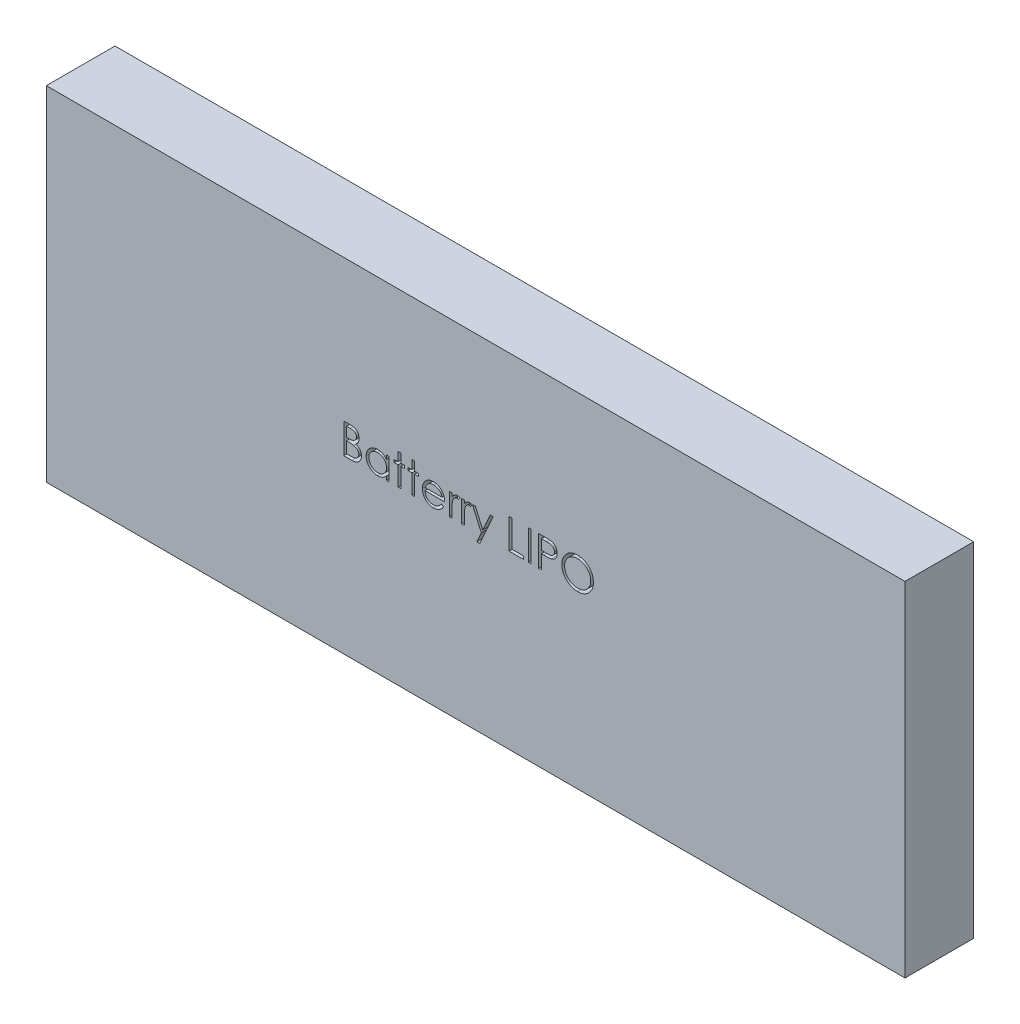
from build123d import *

# Parameters (mm, degrees)
CROQUIS1_W              = 100
CROQUIS1_H              = 40
SALIENTE_EXTRUIR1_DEPTH = 4
CROQUIS2_W              = 0.314102564
CROQUIS2_H              = 3.5
CORTAR_EXTRUIR1_DEPTH   = 25


with BuildPart() as part:
    # Croquis1 → Saliente-Extruir1 (new, symmetric)
    with BuildSketch(Plane.XY):
        Rectangle(CROQUIS1_W, CROQUIS1_H)
    extrude(amount=SALIENTE_EXTRUIR1_DEPTH, both=True)

    # Croquis2 → Cortar-Extruir1 (cut)
    # profile 1 of 12: a face of its own
    with BuildSketch(Plane.XY.offset(4)):
        with BuildLine():
            add(Edge.make_bspline(
                [(11.85499255, 3.58974359), (11.919800656, 3.58810211), (12.047089123, 3.584878109), (12.23416402, 3.560199006), (12.412759116, 3.517503616), (12.584329255, 3.460640633), (12.746822231, 3.384786248), (12.901461124, 3.2931011), (13.047877997, 3.184624641), (13.184099379, 3.060195414), (13.308756329, 2.92481196), (13.418582215, 2.78033405), (13.510624509, 2.627635248), (13.586210296, 2.467174417), (13.645508906, 2.299314449), (13.68642795, 2.123160446), (13.7125661, 1.939853756), (13.715621877, 1.814826892), (13.717172037, 1.751402244)],
                knots=[0, 0, 0, 0, 1.065120563, 2.091984664, 3.0946048, 4.079830382, 5.057816894, 6.036188127, 7.030412546, 8.04752943, 9.064399622, 10.05169764, 11.02544977, 11.989514704, 12.962713494, 13.945757189, 14.957906945, 16, 16, 16, 16], degree=3))
            add(Edge.make_bspline(
                [(13.717172037, 1.751402244), (13.715622104, 1.688444797), (13.712567008, 1.564348377), (13.68639823, 1.382204933), (13.64535723, 1.207114236), (13.586760964, 1.039368583), (13.511535486, 0.87879102), (13.418880315, 0.725804066), (13.309739104, 0.580357567), (13.185532253, 0.444044902), (13.050131211, 0.319047431), (12.904900944, 0.210128556), (12.753107624, 0.116404431), (12.592797916, 0.041620757), (12.426097879, -0.018151163), (12.251515556, -0.058903793), (12.069869002, -0.085190837), (11.945997998, -0.088209353), (11.883037422, -0.08974359)],
                knots=[0, 0, 0, 0, 1.043624062, 2.057103931, 3.04512605, 4.022047818, 4.998200453, 5.980619268, 6.982898556, 8.009068085, 9.034988726, 10.034168286, 11.015286542, 11.987931943, 12.962482838, 13.94673481, 14.956375938, 16, 16, 16, 16], degree=3))
            add(Edge.make_bspline(
                [(11.883037422, -0.08974359), (11.819613103, -0.088194203), (11.694586887, -0.085139949), (11.511049851, -0.058958544), (11.334772107, -0.01801724), (11.166257756, 0.040492196), (11.005412827, 0.116109427), (10.851922744, 0.208313806), (10.706403597, 0.317720947), (10.57006185, 0.441887521), (10.445312652, 0.577059073), (10.336553276, 0.721893329), (10.244328163, 0.873548785), (10.168964831, 1.032446309), (10.109300371, 1.197817752), (10.068595553, 1.370766229), (10.042259601, 1.550305735), (10.039224755, 1.672548634), (10.037684858, 1.734575321)],
                knots=[0, 0, 0, 0, 1.053102029, 2.075944431, 3.073151272, 4.055350789, 5.033113405, 6.020478099, 7.024410459, 8.052272461, 9.079885166, 10.07527673, 11.055994387, 12.023226415, 12.992069828, 13.970394897, 14.97016774, 16, 16, 16, 16], degree=3))
            add(Edge.make_bspline(
                [(10.037684858, 1.734575321), (10.038219493, 1.77620799), (10.039282019, 1.858948113), (10.052073712, 1.981814713), (10.070635413, 2.102705371), (10.097237326, 2.221276319), (10.132028993, 2.337237304), (10.17308102, 2.451388067), (10.223220865, 2.56257179), (10.279901513, 2.671315182), (10.343163321, 2.775923088), (10.413039071, 2.874802671), (10.487074439, 2.968783668), (10.568237833, 3.055430672), (10.653854278, 3.137264328), (10.745312656, 3.213027045), (10.842054901, 3.283401996), (10.94449728, 3.346822337), (11.050115555, 3.404181472), (11.158992333, 3.453403323), (11.269648905, 3.495649384), (11.382603552, 3.529890209), (11.497556325, 3.556922245), (11.614758109, 3.575329599), (11.734115535, 3.588153917), (11.814526854, 3.589211419), (11.85499255, 3.58974359)],
                knots=[0, 0, 0, 0, 1.037015668, 2.060948919, 3.074880161, 4.083647147, 5.086022904, 6.090072063, 7.104153813, 8.122640571, 9.144368836, 10.147691507, 11.138137339, 12.123020368, 13.103399296, 14.087645067, 15.080126199, 16.082011238, 17.087798457, 18.072939717, 19.057185487, 20.037253025, 21.01195951, 21.997135196, 22.992090687, 24, 24, 24, 24], degree=3))
        make_face()
        with BuildLine():
            add(Edge.make_bspline(
                [(11.870417229, 3.230769231), (11.837202596, 3.230364341), (11.771090863, 3.229558431), (11.672806327, 3.218942715), (11.575814393, 3.203812826), (11.480095031, 3.182231305), (11.386048741, 3.152827253), (11.2927989, 3.118986345), (11.201195846, 3.077765254), (11.111541988, 3.03119255), (11.024626913, 2.979643629), (10.942614212, 2.922671862), (10.865291568, 2.861613307), (10.792848301, 2.79632547), (10.725497129, 2.726475868), (10.661912427, 2.653123432), (10.604642846, 2.574171541), (10.552157269, 2.491761134), (10.505189429, 2.405999553), (10.463424074, 2.317789691), (10.429260065, 2.226412004), (10.401397689, 2.132857846), (10.378297878, 2.037275387), (10.363663954, 1.938939538), (10.352931595, 1.838344426), (10.352171749, 1.770362572), (10.351787422, 1.735977564)],
                knots=[0, 0, 0, 0, 1.008559885, 2.007477868, 2.99961109, 3.989939068, 4.984837346, 5.991145699, 7.001802488, 8.033829008, 9.059044045, 10.069351652, 11.065060232, 12.050310815, 13.029377138, 14.011219647, 14.996725999, 15.989392538, 16.977580475, 17.965360261, 18.951710183, 19.937753436, 20.929683414, 21.935841486, 22.955955122, 24, 24, 24, 24], degree=3))
            add(Edge.make_bspline(
                [(10.351787422, 1.735977564), (10.353062284, 1.685415343), (10.355570331, 1.585943813), (10.377527902, 1.440175669), (10.411349876, 1.300087383), (10.461207242, 1.166445474), (10.523557857, 1.038101191), (10.600584747, 0.916193086), (10.691843833, 0.800688212), (10.79550736, 0.692392943), (10.908830066, 0.593547138), (11.029162796, 0.50678373), (11.155216404, 0.43337348), (11.287319606, 0.373568408), (11.424767145, 0.32617867), (11.568444696, 0.293700039), (11.717395156, 0.272324583), (11.818925811, 0.270271827), (11.870417229, 0.269230769)],
                knots=[0, 0, 0, 0, 1.032063989, 2.030389145, 3.003944642, 3.970395727, 4.937377036, 5.913328081, 6.909231446, 7.93887556, 8.970685674, 9.976071282, 10.964166581, 11.944589148, 12.933237628, 13.927779006, 14.949070134, 16, 16, 16, 16], degree=3))
            add(Edge.make_bspline(
                [(11.870417229, 0.269230769), (11.905026731, 0.269706274), (11.973667767, 0.270649342), (12.07576329, 0.280148018), (12.176019501, 0.295379888), (12.274295781, 0.317310543), (12.370480593, 0.34475775), (12.464975396, 0.377365478), (12.556773686, 0.418046682), (12.647033524, 0.462994633), (12.733429766, 0.514234791), (12.815905298, 0.56927294), (12.892381278, 0.630241561), (12.964770349, 0.694559374), (13.032398038, 0.763523221), (13.094807022, 0.837043443), (13.151787155, 0.9155841), (13.204252801, 0.997869506), (13.251056064, 1.083865759), (13.291835163, 1.172395437), (13.326431279, 1.263240546), (13.354359784, 1.356532118), (13.376245245, 1.452092966), (13.391325165, 1.550051045), (13.401873604, 1.650210387), (13.402668681, 1.717954243), (13.403069473, 1.752103365)],
                knots=[0, 0, 0, 0, 1.047197238, 2.076906641, 3.100256066, 4.114471768, 5.12198147, 6.126382909, 7.136867548, 8.15857795, 9.17633901, 10.174870724, 11.156907918, 12.133735059, 13.104061851, 14.077631395, 15.04955518, 16.038496417, 17.029181396, 18.010275684, 18.986308667, 19.968651475, 20.955262928, 21.950658345, 22.966943676, 24, 24, 24, 24], degree=3))
            add(Edge.make_bspline(
                [(13.403069473, 1.752103365), (13.40266836, 1.78601887), (13.401872678, 1.85329652), (13.391330204, 1.952757338), (13.376229313, 2.05001055), (13.354466605, 2.144674353), (13.326416452, 2.236772878), (13.291829121, 2.326219625), (13.251043822, 2.413347821), (13.204235597, 2.497942118), (13.151619774, 2.579116855), (13.094125531, 2.656719268), (13.030760183, 2.729292009), (12.963334158, 2.798626703), (12.890163272, 2.863244593), (12.811578978, 2.923167114), (12.7285353, 2.979840388), (12.640608065, 3.03096595), (12.549864111, 3.078180182), (12.456750153, 3.118631186), (12.362321054, 3.153003305), (12.266816941, 3.18232027), (12.169433963, 3.2037283), (12.070830134, 3.21895635), (11.971141876, 3.229554736), (11.904098656, 3.230363114), (11.870417229, 3.230769231)],
                knots=[0, 0, 0, 0, 1.02996197, 2.043119294, 3.035359645, 4.018872909, 4.991431989, 5.957985074, 6.929999688, 7.912076566, 8.892894881, 9.867085534, 10.843653904, 11.817741046, 12.803660682, 13.806313499, 14.818574707, 15.856120519, 16.894564902, 17.924820532, 18.937903209, 19.946497019, 20.957711757, 21.963978472, 22.977135795, 24, 24, 24, 24], degree=3))
        make_face(mode=Mode.SUBTRACT)
    # profile 2 of 12: a face of its own
    with BuildSketch(Plane.XY.offset(4)):
        with BuildLine():
            Line((7.345377165, 3.5), (8.031775402, 3.5))
            add(Edge.make_bspline(
                [(8.031775402, 3.5), (8.078986309, 3.499948104), (8.169444501, 3.499848668), (8.299159557, 3.496833922), (8.416969289, 3.49280723), (8.52261967, 3.487225337), (8.616435768, 3.480628747), (8.697993067, 3.471376708), (8.767932624, 3.461716412), (8.809839073, 3.451895005), (8.828950883, 3.447415865)],
                knots=[0, 0, 0, 0, 1.415646017, 2.712440637, 3.8905458, 4.950247383, 5.884950622, 6.709939814, 7.411656543, 8, 8, 8, 8], degree=3))
            add(Edge.make_bspline(
                [(8.828950883, 3.447415865), (8.853144417, 3.440793916), (8.900961394, 3.427706054), (8.969862437, 3.40149233), (9.035416283, 3.370410165), (9.097847841, 3.334986225), (9.156389924, 3.293700661), (9.211915965, 3.248227043), (9.263935946, 3.197515475), (9.312157337, 3.142134735), (9.356442135, 3.083014525), (9.394571818, 3.019272295), (9.426499045, 2.951980992), (9.453882316, 2.881187421), (9.473590771, 2.806297097), (9.48843767, 2.727830385), (9.497861298, 2.645795695), (9.49876386, 2.589735827), (9.499223319, 2.561197917)],
                knots=[0, 0, 0, 0, 0.999701418, 1.975846123, 2.934577507, 3.890451536, 4.834027766, 5.787354733, 6.749476667, 7.726910423, 8.712836071, 9.690891519, 10.682875813, 11.679750201, 12.712814741, 13.765529915, 14.8625177, 16, 16, 16, 16], degree=3))
            add(Edge.make_bspline(
                [(9.499223319, 2.561197917), (9.498801894, 2.53242014), (9.497977348, 2.476114476), (9.488081063, 2.393741688), (9.474750871, 2.315023298), (9.454253819, 2.240133847), (9.427408146, 2.169518077), (9.395916093, 2.102096845), (9.357932563, 2.039017173), (9.314287733, 1.980050055), (9.265736139, 1.925140143), (9.212483201, 1.874685348), (9.154743908, 1.82898101), (9.09270176, 1.787924666), (9.025751911, 1.752468387), (8.954909758, 1.720711082), (8.879559541, 1.694040021), (8.827417027, 1.68000996), (8.800906011, 1.672876603)],
                knots=[0, 0, 0, 0, 1.121902311, 2.195077645, 3.232258892, 4.234102512, 5.217864754, 6.176164875, 7.132989551, 8.084763148, 9.034132444, 9.988522005, 10.94243251, 11.903244335, 12.886203696, 13.894208494, 14.929344452, 16, 16, 16, 16], degree=3))
            add(Edge.make_bspline(
                [(8.800906011, 1.672876603), (8.778978677, 1.668213621), (8.73092365, 1.657994427), (8.651780928, 1.64658597), (8.559635542, 1.63684837), (8.454613262, 1.629547232), (8.336808357, 1.623296864), (8.2061571, 1.61832877), (8.062403023, 1.615598916), (7.962131778, 1.615458123), (7.90978021, 1.615384615)],
                knots=[0, 0, 0, 0, 0.601384939, 1.31797006, 2.144135048, 3.087295005, 4.142315834, 5.309527816, 6.595305764, 8, 8, 8, 8], degree=3))
            Line((7.90978021, 1.615384615), (7.659479729, 1.615384615))
            Line((7.659479729, 1.615384615), (7.659479729, 0))
            Line((7.659479729, 0), (7.345377165, 0))
            Line((7.345377165, 0), (7.345377165, 3.5))
        make_face()
        with BuildLine():
            Line((7.659479729, 3.141025641), (7.659479729, 1.974358974))
            Line((7.659479729, 1.974358974), (8.272260178, 1.966646635))
            add(Edge.make_bspline(
                [(8.272260178, 1.966646635), (8.302180104, 1.966631171), (8.359939904, 1.966601319), (8.443376127, 1.970586542), (8.520785414, 1.975187075), (8.59192999, 1.981922998), (8.656841924, 1.991444256), (8.715629453, 2.001055994), (8.767836736, 2.014961356), (8.828935938, 2.033684426), (8.897019285, 2.065617041), (8.971086834, 2.111966931), (9.03385742, 2.17104764), (9.088175717, 2.237475471), (9.131281595, 2.3113746), (9.162837587, 2.390443537), (9.181378744, 2.473871387), (9.183864938, 2.530959525), (9.185120755, 2.559795673)],
                knots=[0, 0, 0, 0, 1.160613943, 2.240541288, 3.23993089, 4.169200891, 5.011653406, 5.7853311, 6.478053781, 7.106038997, 8.262395093, 9.384106736, 10.481365981, 11.59014053, 12.70357646, 13.786202915, 14.881775077, 16, 16, 16, 16], degree=3))
            add(Edge.make_bspline(
                [(9.185120755, 2.559795673), (9.183858108, 2.587934187), (9.181348123, 2.643870069), (9.16269226, 2.725848829), (9.131342946, 2.804084534), (9.087886352, 2.877057619), (9.035145222, 2.943246423), (8.973845879, 3.00074355), (8.904132618, 3.046965253), (8.839284387, 3.076798534), (8.7816832, 3.09501381), (8.731651241, 3.10775865), (8.675160566, 3.117934257), (8.612192787, 3.126173759), (8.543235953, 3.133227221), (8.467697638, 3.138013198), (8.385863995, 3.140814654), (8.329053424, 3.140953609), (8.299603928, 3.141025641)],
                knots=[0, 0, 0, 0, 1.120700087, 2.227813068, 3.331159281, 4.466773991, 5.599788987, 6.693661531, 7.80175334, 8.91857717, 9.525282508, 10.207424825, 10.974604443, 11.810962634, 12.737642355, 13.736264703, 14.826523623, 16, 16, 16, 16], degree=3))
            Line((8.299603928, 3.141025641), (7.659479729, 3.141025641))
        make_face(mode=Mode.SUBTRACT)
    # profile 3 of 12: a face of its own
    with BuildSketch(Plane.XY.offset(4)):
        with Locations((6.290889986, 1.75)):
            Rectangle(CROQUIS2_W, CROQUIS2_H)
    # profile 4 of 12: a face of its own
    with BuildSketch(Plane.XY.offset(4)):
        Polygon((3.89024896, 3.5), (4.204351524, 3.5), (4.204351524, 0.358974359), (5.55050537, 0.358974359), (5.55050537, 0), (3.89024896, 0), align=None)
    # profile 5 of 12: a face of its own
    with BuildSketch(Plane.XY.offset(4)):
        Polygon((-0.372571553, 2.557692308), (-0.033929726, 2.557692308), (0.831955691, 0.598758013), (1.711162422, 2.557692308), (2.05050537, 2.557692308), (0.47999255, -0.942307692), (0.140649601, -0.942307692), (0.661583095, 0.218048878), align=None)
    # profile 6 of 12: a face of its own
    with BuildSketch(Plane.XY.offset(4)):
        with BuildLine():
            Line((-1.628981809, 2.557692308), (-1.314879245, 2.557692308))
            Line((-1.314879245, 2.557692308), (-1.314879245, 2.181189904))
            add(Edge.make_bspline(
                [(-1.314879245, 2.181189904), (-1.291690486, 2.216245732), (-1.247342165, 2.283289731), (-1.173629236, 2.371959032), (-1.098125905, 2.445374079), (-1.020470717, 2.503877598), (-0.940092618, 2.547690717), (-0.858755666, 2.579783752), (-0.775180196, 2.598761067), (-0.719018272, 2.601294726), (-0.690880848, 2.602564103)],
                knots=[0, 0, 0, 0, 1.2804753, 2.448899062, 3.506932113, 4.484331642, 5.4025378, 6.288909075, 7.142734305, 8, 8, 8, 8], degree=3))
            add(Edge.make_bspline(
                [(-0.690880848, 2.602564103), (-0.669054521, 2.601373576), (-0.624145436, 2.59892399), (-0.556162846, 2.581713165), (-0.486119394, 2.554235143), (-0.440977007, 2.52839492), (-0.417443348, 2.514923878)],
                knots=[0, 0, 0, 0, 0.901110191, 1.854092781, 2.881294221, 4, 4, 4, 4], degree=3))
            Line((-0.417443348, 2.514923878), (-0.589919309, 2.242888622))
            add(Edge.make_bspline(
                [(-0.589919309, 2.242888622), (-0.60502833, 2.249628888), (-0.633708145, 2.262423203), (-0.675662711, 2.277565213), (-0.714344048, 2.286481129), (-0.738987606, 2.287831847), (-0.7504762, 2.288461538)],
                knots=[0, 0, 0, 0, 1.180555205, 2.24091978, 3.179933427, 4, 4, 4, 4], degree=3))
            add(Edge.make_bspline(
                [(-0.7504762, 2.288461538), (-0.775681934, 2.286781501), (-0.827094324, 2.283354712), (-0.902578823, 2.256415904), (-0.975826029, 2.212890664), (-1.033997691, 2.164619552), (-1.079039944, 2.118071755), (-1.111180169, 2.077423352), (-1.140662916, 2.031844721), (-1.168833137, 1.982115037), (-1.194499431, 1.927385191), (-1.2184541, 1.868201977), (-1.240112963, 1.804496849), (-1.252463207, 1.760114328), (-1.258789501, 1.737379808)],
                knots=[0, 0, 0, 0, 1.125678352, 2.296057538, 3.5422874, 4.923748041, 5.663163013, 6.437101912, 7.23742474, 8.08941207, 8.991984279, 9.93940061, 10.944477711, 12, 12, 12, 12], degree=3))
            add(Edge.make_bspline(
                [(-1.258789501, 1.737379808), (-1.263521895, 1.717102634), (-1.274003787, 1.672190235), (-1.284195324, 1.596841711), (-1.294264842, 1.507818052), (-1.301361461, 1.404871459), (-1.307939503, 1.288259015), (-1.311649585, 1.15780307), (-1.314752726, 1.013369718), (-1.314835792, 0.912395365), (-1.314879245, 0.859575321)],
                knots=[0, 0, 0, 0, 0.566838948, 1.255505196, 2.06880316, 3.007127437, 4.065329342, 5.249902469, 6.561414163, 8, 8, 8, 8], degree=3))
            Line((-1.314879245, 0.859575321), (-1.314879245, 0))
            Line((-1.314879245, 0), (-1.628981809, 0))
            Line((-1.628981809, 0), (-1.628981809, 2.557692308))
        make_face()
    # profile 7 of 12: a face of its own
    with BuildSketch(Plane.XY.offset(4)):
        with BuildLine():
            Line((-3.064879245, 2.557692308), (-2.750776681, 2.557692308))
            Line((-2.750776681, 2.557692308), (-2.750776681, 2.181189904))
            add(Edge.make_bspline(
                [(-2.750776681, 2.181189904), (-2.727587922, 2.216245732), (-2.683239601, 2.283289731), (-2.609526672, 2.371959032), (-2.534023341, 2.445374079), (-2.456368153, 2.503877598), (-2.375990053, 2.547690717), (-2.294653102, 2.579783752), (-2.211077632, 2.598761067), (-2.154915708, 2.601294726), (-2.126778284, 2.602564103)],
                knots=[0, 0, 0, 0, 1.2804753, 2.448899062, 3.506932113, 4.484331642, 5.4025378, 6.288909075, 7.142734305, 8, 8, 8, 8], degree=3))
            add(Edge.make_bspline(
                [(-2.126778284, 2.602564103), (-2.104951957, 2.601373576), (-2.060042872, 2.59892399), (-1.992060282, 2.581713165), (-1.92201683, 2.554235143), (-1.876874443, 2.52839492), (-1.853340784, 2.514923878)],
                knots=[0, 0, 0, 0, 0.901110191, 1.854092781, 2.881294221, 4, 4, 4, 4], degree=3))
            Line((-1.853340784, 2.514923878), (-2.025816745, 2.242888622))
            add(Edge.make_bspline(
                [(-2.025816745, 2.242888622), (-2.040925766, 2.249628888), (-2.069605581, 2.262423203), (-2.111560147, 2.277565213), (-2.150241484, 2.286481129), (-2.174885042, 2.287831847), (-2.186373636, 2.288461538)],
                knots=[0, 0, 0, 0, 1.180555205, 2.24091978, 3.179933427, 4, 4, 4, 4], degree=3))
            add(Edge.make_bspline(
                [(-2.186373636, 2.288461538), (-2.21157937, 2.286781501), (-2.26299176, 2.283354712), (-2.338476259, 2.256415904), (-2.411723464, 2.212890664), (-2.469895127, 2.164619552), (-2.51493738, 2.118071755), (-2.547077605, 2.077423352), (-2.576560352, 2.031844721), (-2.604730573, 1.982115037), (-2.630396867, 1.927385191), (-2.654351536, 1.868201977), (-2.676010399, 1.804496849), (-2.688360643, 1.760114328), (-2.694686937, 1.737379808)],
                knots=[0, 0, 0, 0, 1.125678352, 2.296057538, 3.5422874, 4.923748041, 5.663163013, 6.437101912, 7.23742474, 8.08941207, 8.991984279, 9.93940061, 10.944477711, 12, 12, 12, 12], degree=3))
            add(Edge.make_bspline(
                [(-2.694686937, 1.737379808), (-2.699419331, 1.717102634), (-2.709901222, 1.672190235), (-2.72009276, 1.596841711), (-2.730162278, 1.507818052), (-2.737258897, 1.404871459), (-2.743836939, 1.288259015), (-2.747547021, 1.15780307), (-2.750650161, 1.013369718), (-2.750733228, 0.912395365), (-2.750776681, 0.859575321)],
                knots=[0, 0, 0, 0, 0.566838948, 1.255505196, 2.06880316, 3.007127437, 4.065329342, 5.249902469, 6.561414163, 8, 8, 8, 8], degree=3))
            Line((-2.750776681, 0.859575321), (-2.750776681, 0))
            Line((-2.750776681, 0), (-3.064879245, 0))
            Line((-3.064879245, 0), (-3.064879245, 2.557692308))
        make_face()
    # profile 8 of 12: a face of its own
    with BuildSketch(Plane.XY.offset(4)):
        with BuildLine():
            Line((-4.017002642, 0.807692308), (-3.737956168, 0.661157853))
            add(Edge.make_bspline(
                [(-3.737956168, 0.661157853), (-3.760192763, 0.621714521), (-3.803456372, 0.544973418), (-3.87785712, 0.439541558), (-3.955849192, 0.344693842), (-4.04095316, 0.262964188), (-4.130622839, 0.191712803), (-4.225355494, 0.129374978), (-4.325644312, 0.076256458), (-4.431494037, 0.03150393), (-4.543793588, -0.002905564), (-4.662815104, -0.027209785), (-4.7887866, -0.042233054), (-4.875132779, -0.043978194), (-4.919346392, -0.044871795)],
                knots=[0, 0, 0, 0, 1.120438281, 2.179929193, 3.190490725, 4.156257408, 5.095198341, 6.022838206, 6.959905092, 7.901321166, 8.864066838, 9.862729781, 10.905609505, 12, 12, 12, 12], degree=3))
            add(Edge.make_bspline(
                [(-4.919346392, -0.044871795), (-4.96848837, -0.04372462), (-5.064350132, -0.041486813), (-5.203889879, -0.022194348), (-5.335269297, 0.00927801), (-5.458481001, 0.053243552), (-5.573223253, 0.110670876), (-5.679724108, 0.180630358), (-5.778543634, 0.262762612), (-5.866567843, 0.357779056), (-5.945811726, 0.459461013), (-6.015737546, 0.565416898), (-6.074194977, 0.675380122), (-6.121747587, 0.788650646), (-6.160152452, 0.90451454), (-6.186919156, 1.024026007), (-6.202348904, 1.146861592), (-6.204713349, 1.229958927), (-6.205904886, 1.271834936)],
                knots=[0, 0, 0, 0, 1.145258523, 2.234067595, 3.276747158, 4.290159414, 5.277019952, 6.260822364, 7.254936242, 8.264827045, 9.274100331, 10.257902744, 11.220704747, 12.172965371, 13.118907548, 14.062713208, 15.023725156, 16, 16, 16, 16], degree=3))
            add(Edge.make_bspline(
                [(-6.205904886, 1.271834936), (-6.204845745, 1.311129766), (-6.202746666, 1.389006931), (-6.189515879, 1.504272476), (-6.166067586, 1.616300928), (-6.133891262, 1.725185376), (-6.092340016, 1.83074351), (-6.041507797, 1.933039574), (-5.981315419, 2.031964713), (-5.934842745, 2.094367847), (-5.911433732, 2.125801282)],
                knots=[0, 0, 0, 0, 1.024358464, 2.0301432, 3.019427413, 4.004406732, 4.986367066, 5.972626655, 6.978780325, 8, 8, 8, 8], degree=3))
            add(Edge.make_bspline(
                [(-5.911433732, 2.125801282), (-5.879726049, 2.163670152), (-5.817315103, 2.238208303), (-5.711758747, 2.336146628), (-5.597458551, 2.418190404), (-5.475846925, 2.48619754), (-5.345510451, 2.537871187), (-5.20820116, 2.576378769), (-5.062355574, 2.59795678), (-4.962650353, 2.601004614), (-4.911634053, 2.602564103)],
                knots=[0, 0, 0, 0, 1.030682036, 2.02871468, 2.997146059, 3.962720338, 4.930598197, 5.918074684, 6.934738563, 8, 8, 8, 8], degree=3))
            add(Edge.make_bspline(
                [(-4.911634053, 2.602564103), (-4.859186447, 2.601210054), (-4.756296201, 2.598553718), (-4.60626408, 2.573927385), (-4.464303364, 2.53487483), (-4.33047086, 2.47972104), (-4.204752999, 2.408561488), (-4.087966949, 2.320419647), (-3.978115437, 2.218001559), (-3.914206858, 2.13923835), (-3.881686136, 2.099158654)],
                knots=[0, 0, 0, 0, 1.056321875, 2.072262726, 3.055038591, 4.01806755, 4.982017516, 5.957941055, 6.960871419, 8, 8, 8, 8], degree=3))
            add(Edge.make_bspline(
                [(-3.881686136, 2.099158654), (-3.859559198, 2.068955072), (-3.815452605, 2.008748954), (-3.760205505, 1.910577797), (-3.71224811, 1.807867202), (-3.673915149, 1.698956905), (-3.642875647, 1.585137325), (-3.620418829, 1.46559478), (-3.60724921, 1.340364869), (-3.604660513, 1.255038314), (-3.603340784, 1.211538462)],
                knots=[0, 0, 0, 0, 0.94817472, 1.890038105, 2.849395472, 3.817997239, 4.812318967, 5.836947057, 6.897266129, 8, 8, 8, 8], degree=3))
            Line((-3.603340784, 1.211538462), (-5.891802322, 1.211538462))
            add(Edge.make_bspline(
                [(-5.891802322, 1.211538462), (-5.890262716, 1.177837997), (-5.887235142, 1.111567394), (-5.873119998, 1.01459661), (-5.850871225, 0.922223268), (-5.819602162, 0.835140226), (-5.781735317, 0.752210099), (-5.7353496, 0.674048062), (-5.680010046, 0.601010132), (-5.618284347, 0.532442994), (-5.549577251, 0.471382233), (-5.477294504, 0.416730457), (-5.400400939, 0.37092486), (-5.319502856, 0.33374497), (-5.23473107, 0.304638654), (-5.146058875, 0.284770834), (-5.053660759, 0.271463727), (-4.990675025, 0.269984061), (-4.958609213, 0.269230769)],
                knots=[0, 0, 0, 0, 1.094153842, 2.151609401, 3.174256925, 4.172055639, 5.149267565, 6.128595816, 7.11444997, 8.118368179, 9.117203808, 10.09244225, 11.054858984, 12.015122123, 12.976791628, 13.957293641, 14.960065497, 16, 16, 16, 16], degree=3))
            add(Edge.make_bspline(
                [(-4.958609213, 0.269230769), (-4.927258065, 0.269838826), (-4.865051374, 0.271045327), (-4.772410517, 0.282777238), (-4.68127099, 0.301747513), (-4.592010006, 0.327637504), (-4.506439161, 0.359214356), (-4.42719361, 0.397317213), (-4.354313395, 0.43946696), (-4.286196428, 0.487676635), (-4.220125435, 0.546684822), (-4.154582948, 0.620320543), (-4.084306295, 0.707408071), (-4.040316702, 0.772953737), (-4.017002642, 0.807692308)],
                knots=[0, 0, 0, 0, 0.99110716, 1.966546729, 2.947904876, 3.932708344, 4.903319531, 5.828989031, 6.710028674, 7.56322171, 8.463672341, 9.504779593, 10.677557249, 12, 12, 12, 12], degree=3))
        make_face()
        with BuildLine():
            add(Edge.make_bspline(
                [(-3.917443348, 1.525641026), (-3.928939972, 1.567303899), (-3.951067274, 1.64749152), (-3.997303638, 1.75853241), (-4.049375179, 1.857220311), (-4.11099691, 1.942799944), (-4.180815636, 2.018803457), (-4.261460818, 2.085222043), (-4.351896712, 2.144639494), (-4.451655853, 2.194791993), (-4.557297638, 2.237481852), (-4.66790383, 2.266106968), (-4.780761618, 2.28571651), (-4.857095904, 2.287542618), (-4.895508251, 2.288461538)],
                knots=[0, 0, 0, 0, 1.154881502, 2.222775134, 3.210006277, 4.132804581, 5.035138423, 5.962687519, 6.919655026, 7.923214229, 8.944639381, 9.960483929, 10.97369054, 12, 12, 12, 12], degree=3))
            add(Edge.make_bspline(
                [(-4.895508251, 2.288461538), (-4.92685769, 2.287849867), (-4.988828939, 2.286640721), (-5.080130007, 2.275170592), (-5.167809706, 2.256210747), (-5.252514994, 2.23024579), (-5.333135862, 2.195637188), (-5.41133063, 2.155053961), (-5.485111027, 2.105512377), (-5.531252322, 2.067753522), (-5.554562739, 2.048677885)],
                knots=[0, 0, 0, 0, 1.04873581, 2.073130211, 3.073294108, 4.04793562, 5.032784715, 6.005352987, 6.992311501, 8, 8, 8, 8], degree=3))
            add(Edge.make_bspline(
                [(-5.554562739, 2.048677885), (-5.571256021, 2.033583569), (-5.605039155, 2.003036353), (-5.650179676, 1.950407146), (-5.693400149, 1.893655584), (-5.732733802, 1.83061046), (-5.768811388, 1.761989681), (-5.802571365, 1.688372045), (-5.832957777, 1.609198915), (-5.850053888, 1.554026476), (-5.858849598, 1.525641026)],
                knots=[0, 0, 0, 0, 0.879870761, 1.780643979, 2.707998968, 3.669668524, 4.684282772, 5.740141944, 6.837334558, 8, 8, 8, 8], degree=3))
            Line((-5.858849598, 1.525641026), (-3.917443348, 1.525641026))
        make_face(mode=Mode.SUBTRACT)
    # profile 9 of 12: a face of its own
    with BuildSketch(Plane.XY.offset(4)):
        Polygon((-7.417443348, 3.58974359), (-7.103340784, 3.58974359), (-7.103340784, 2.557692308), (-6.654622835, 2.557692308), (-6.654622835, 2.243589744), (-7.103340784, 2.243589744), (-7.103340784, 0), (-7.417443348, 0), (-7.417443348, 2.243589744), (-7.866161296, 2.243589744), (-7.866161296, 2.557692308), (-7.417443348, 2.557692308), align=None)
    # profile 10 of 12: a face of its own
    with BuildSketch(Plane.XY.offset(4)):
        Polygon((-9.032827963, 3.58974359), (-8.718725399, 3.58974359), (-8.718725399, 2.557692308), (-8.27000745, 2.557692308), (-8.27000745, 2.243589744), (-8.718725399, 2.243589744), (-8.718725399, 0), (-9.032827963, 0), (-9.032827963, 2.243589744), (-9.481545912, 2.243589744), (-9.481545912, 2.557692308), (-9.032827963, 2.557692308), align=None)
    # profile 11 of 12: a face of its own
    with BuildSketch(Plane.XY.offset(4)):
        with BuildLine():
            Line((-10.064879245, 2.557692308), (-10.064879245, 0))
            Line((-10.064879245, 0), (-10.378981809, 0))
            Line((-10.378981809, 0), (-10.378981809, 0.442407853))
            add(Edge.make_bspline(
                [(-10.378981809, 0.442407853), (-10.4144006, 0.402368259), (-10.483520815, 0.324230488), (-10.598961933, 0.222148315), (-10.721330111, 0.137769993), (-10.850031432, 0.069620078), (-10.984949675, 0.018428021), (-11.125785763, -0.017958138), (-11.272597144, -0.041351973), (-11.372849498, -0.043687995), (-11.423653284, -0.044871795)],
                knots=[0, 0, 0, 0, 1.074387032, 2.096679803, 3.090159297, 4.057316773, 5.018401886, 5.985159533, 6.978961417, 8, 8, 8, 8], degree=3))
            add(Edge.make_bspline(
                [(-11.423653284, -0.044871795), (-11.468821237, -0.043645423), (-11.557894442, -0.041226962), (-11.688923519, -0.022464659), (-11.815015769, 0.007665963), (-11.936290341, 0.049566853), (-12.051962487, 0.105147674), (-12.163022584, 0.171688922), (-12.268895276, 0.250929752), (-12.367966815, 0.341517781), (-12.459198815, 0.439912768), (-12.539260088, 0.544858315), (-12.606013167, 0.655900619), (-12.661833248, 0.771633773), (-12.704829593, 0.892948692), (-12.734803227, 1.01942586), (-12.753543674, 1.150915734), (-12.755961134, 1.240455257), (-12.757186937, 1.285857372)],
                knots=[0, 0, 0, 0, 1.033919861, 2.038935746, 3.024066025, 3.998881131, 4.97069526, 5.957263378, 6.95902576, 7.993208707, 9.027059324, 10.027763471, 11.009749337, 11.988697705, 12.965288445, 13.950418724, 14.960734635, 16, 16, 16, 16], degree=3))
            add(Edge.make_bspline(
                [(-12.757186937, 1.285857372), (-12.755933966, 1.330321075), (-12.753456909, 1.418223419), (-12.735003689, 1.547502117), (-12.703972681, 1.672020377), (-12.660424833, 1.791377321), (-12.604582878, 1.905717371), (-12.536654791, 2.015121396), (-12.456635666, 2.119890793), (-12.364383259, 2.21756202), (-12.264448489, 2.307782634), (-12.157539758, 2.38619168), (-12.046316477, 2.453908529), (-11.929053466, 2.507562005), (-11.807486362, 2.550971109), (-11.680532916, 2.581004078), (-11.548721337, 2.598701399), (-11.459230845, 2.601264163), (-11.413837578, 2.602564103)],
                knots=[0, 0, 0, 0, 1.020392517, 2.01726096, 2.990465484, 3.961182959, 4.928053699, 5.906110375, 6.912531644, 7.948652711, 8.985773172, 9.998621852, 10.987621588, 11.969261332, 12.953316658, 13.946091881, 14.958173133, 16, 16, 16, 16], degree=3))
            add(Edge.make_bspline(
                [(-11.413837578, 2.602564103), (-11.361637719, 2.601126351), (-11.259276259, 2.598306988), (-11.10954825, 2.574844261), (-10.967903772, 2.535205794), (-10.83324942, 2.481288296), (-10.706068734, 2.409639567), (-10.58756575, 2.319259606), (-10.476500266, 2.210718419), (-10.412119975, 2.127347974), (-10.378981809, 2.084435096)],
                knots=[0, 0, 0, 0, 1.038897134, 2.037228247, 3.008116434, 3.962042015, 4.918381754, 5.904844433, 6.921570401, 8, 8, 8, 8], degree=3))
            Line((-10.378981809, 2.084435096), (-10.378981809, 2.557692308))
            Line((-10.378981809, 2.557692308), (-10.064879245, 2.557692308))
        make_face()
        with BuildLine():
            add(Edge.make_bspline(
                [(-11.409630848, 2.288461538), (-11.455545185, 2.286827901), (-11.546172785, 2.28360336), (-11.679216788, 2.258429865), (-11.806530202, 2.21654527), (-11.927476276, 2.159263369), (-12.040144492, 2.087234632), (-12.140838163, 2.000113249), (-12.230380865, 1.900276235), (-12.305689129, 1.788174125), (-12.367079626, 1.667996033), (-12.410246658, 1.542371595), (-12.438715905, 1.413566618), (-12.441624426, 1.326203932), (-12.443084373, 1.282351763)],
                knots=[0, 0, 0, 0, 1.031046209, 2.035121221, 3.029706178, 4.034933723, 5.034054252, 6.02443088, 7.017295772, 8.038157696, 9.050218397, 10.03989886, 11.016116709, 12, 12, 12, 12], degree=3))
            add(Edge.make_bspline(
                [(-12.443084373, 1.282351763), (-12.44121948, 1.238761656), (-12.437497003, 1.1517523), (-12.410746309, 1.022771723), (-12.365866435, 0.897117681), (-12.304624373, 0.775856687), (-12.227937748, 0.663272587), (-12.139049095, 0.561532464), (-12.037098814, 0.474042876), (-11.924171307, 0.400805303), (-11.803563336, 0.341642782), (-11.676729405, 0.300477142), (-11.546053767, 0.273899362), (-11.457201433, 0.270794885), (-11.412435335, 0.269230769)],
                knots=[0, 0, 0, 0, 0.979072187, 1.954306742, 2.945804271, 3.96968567, 4.997920485, 5.998718438, 6.996577872, 8.005894225, 9.015743152, 10.005417472, 10.995077863, 12, 12, 12, 12], degree=3))
            add(Edge.make_bspline(
                [(-11.412435335, 0.269230769), (-11.366988832, 0.270890733), (-11.276600246, 0.274192237), (-11.143161538, 0.299473502), (-11.013666575, 0.3412423), (-10.889879346, 0.399141427), (-10.774563215, 0.470898783), (-10.671065338, 0.554905874), (-10.583549369, 0.652609058), (-10.50935676, 0.759985511), (-10.451181343, 0.877697508), (-10.408805284, 1.003031698), (-10.383751378, 1.135992447), (-10.380593648, 1.226856374), (-10.378981809, 1.273237179)],
                knots=[0, 0, 0, 0, 1.01762866, 2.023962475, 3.030623092, 4.058876274, 5.077231937, 6.066672613, 7.034107872, 8.005628644, 8.981990164, 9.965428785, 10.961468474, 12, 12, 12, 12], degree=3))
            add(Edge.make_bspline(
                [(-10.378981809, 1.273237179), (-10.379941466, 1.30857501), (-10.381830373, 1.378131043), (-10.396260942, 1.480258561), (-10.419215869, 1.577992287), (-10.451562039, 1.671434976), (-10.494053323, 1.760069991), (-10.545301089, 1.844533752), (-10.606206539, 1.924386963), (-10.675789235, 1.998530034), (-10.751954438, 2.066156496), (-10.832548978, 2.126520737), (-10.918527725, 2.17610951), (-11.008444762, 2.217150781), (-11.102456097, 2.249809931), (-11.201326716, 2.271597625), (-11.304005703, 2.286557946), (-11.374051759, 2.287820327), (-11.409630848, 2.288461538)],
                knots=[0, 0, 0, 0, 1.050140795, 2.067009409, 3.05949893, 4.030605086, 5.00011959, 5.97591094, 6.962425594, 7.979863591, 8.993523472, 9.986985069, 10.967611495, 11.937549037, 12.921786183, 13.919465291, 14.943216303, 16, 16, 16, 16], degree=3))
        make_face(mode=Mode.SUBTRACT)
    # profile 12 of 12: a face of its own
    with BuildSketch(Plane.XY.offset(4)):
        with BuildLine():
            Line((-15.35975104, 3.5), (-14.676858412, 3.5))
            add(Edge.make_bspline(
                [(-14.676858412, 3.5), (-14.643429934, 3.49982425), (-14.578637223, 3.499483602), (-14.484417781, 3.49420047), (-14.396168971, 3.486996801), (-14.313865198, 3.475566708), (-14.237544496, 3.461774931), (-14.166976859, 3.445073115), (-14.102386686, 3.425046501), (-14.02527395, 3.39320022), (-13.937353289, 3.345877051), (-13.842154896, 3.275948486), (-13.760750657, 3.190416023), (-13.69056434, 3.093933368), (-13.63476322, 2.987797596), (-13.594393923, 2.874538407), (-13.568836048, 2.755616665), (-13.566207613, 2.673973487), (-13.564879245, 2.63271234)],
                knots=[0, 0, 0, 0, 1.001505555, 1.941167018, 2.826882275, 3.653841531, 4.429895133, 5.150066043, 5.825578002, 6.45369114, 7.647487171, 8.808567382, 9.977351308, 11.170798116, 12.373658725, 13.556498008, 14.765093433, 16, 16, 16, 16], degree=3))
            add(Edge.make_bspline(
                [(-13.564879245, 2.63271234), (-13.565972463, 2.594059784), (-13.568120741, 2.518103867), (-13.5886635, 2.407009758), (-13.620824169, 2.301258539), (-13.665529418, 2.201236154), (-13.723631414, 2.10920254), (-13.792489733, 2.024415274), (-13.875566535, 1.950464217), (-13.937809775, 1.909121315), (-13.969426521, 1.888120994)],
                knots=[0, 0, 0, 0, 1.044552857, 2.05264487, 3.044412934, 4.028983338, 5.005914585, 5.980388656, 6.974128949, 8, 8, 8, 8], degree=3))
            add(Edge.make_bspline(
                [(-13.969426521, 1.888120994), (-13.929666093, 1.872855995), (-13.853594546, 1.84365027), (-13.748908533, 1.792014806), (-13.658713688, 1.735852696), (-13.582316542, 1.674520846), (-13.516978887, 1.608412035), (-13.459925946, 1.536556921), (-13.411244572, 1.458018163), (-13.369531648, 1.373614627), (-13.336982892, 1.284208159), (-13.312606988, 1.190637383), (-13.298639539, 1.093237828), (-13.296651897, 1.026952448), (-13.295648476, 0.993489583)],
                knots=[0, 0, 0, 0, 1.27268992, 2.434971085, 3.483601985, 4.442670788, 5.356604649, 6.2567628, 7.179492994, 8.113709626, 9.066344395, 10.018646069, 10.999752585, 12, 12, 12, 12], degree=3))
            add(Edge.make_bspline(
                [(-13.295648476, 0.993489583), (-13.296625322, 0.959322711), (-13.298547294, 0.892098433), (-13.312727266, 0.793343299), (-13.336736373, 0.698968352), (-13.369807519, 0.608363169), (-13.412969834, 0.521703035), (-13.465497798, 0.438889771), (-13.528129361, 0.36075544), (-13.59819223, 0.286431817), (-13.677454376, 0.21960403), (-13.762970131, 0.160088323), (-13.855816451, 0.111142261), (-13.954468445, 0.070026239), (-14.060032761, 0.038619041), (-14.172035368, 0.016646467), (-14.29037967, 0.00184143), (-14.371589421, 0.000624225), (-14.413236617, 0)],
                knots=[0, 0, 0, 0, 0.978564426, 1.925352924, 2.850884081, 3.763762016, 4.682927383, 5.618979971, 6.567305752, 7.547517671, 8.540179244, 9.531824382, 10.526200242, 11.540722885, 12.589160233, 13.674978461, 14.80764778, 16, 16, 16, 16], degree=3))
            Line((-14.413236617, 0), (-15.35975104, 0))
            Line((-15.35975104, 0), (-15.35975104, 3.5))
        make_face()
        with BuildLine():
            Line((-15.045648476, 3.141025641), (-15.045648476, 2.019230769))
            Line((-15.045648476, 2.019230769), (-14.834610816, 2.019230769))
            add(Edge.make_bspline(
                [(-14.834610816, 2.019230769), (-14.80376202, 2.019630692), (-14.744155861, 2.020403425), (-14.657835964, 2.022616942), (-14.577710946, 2.028814985), (-14.503919113, 2.035011248), (-14.436576669, 2.045085835), (-14.375832808, 2.057077958), (-14.320734211, 2.069760863), (-14.257194665, 2.09133035), (-14.185121717, 2.123208025), (-14.108288613, 2.172679861), (-14.040554143, 2.231604215), (-13.983356955, 2.299595176), (-13.936545485, 2.374461362), (-13.90403177, 2.455008243), (-13.881984485, 2.539228375), (-13.879992954, 2.597046627), (-13.878981809, 2.626402244)],
                knots=[0, 0, 0, 0, 1.156816544, 2.235205308, 3.236616184, 4.169592532, 5.011045266, 5.787822928, 6.49130361, 7.128639758, 8.301311294, 9.436451833, 10.541879658, 11.654887649, 12.756523258, 13.837046038, 14.901820046, 16, 16, 16, 16], degree=3))
            add(Edge.make_bspline(
                [(-13.878981809, 2.626402244), (-13.879507989, 2.645828015), (-13.880540149, 2.683933787), (-13.888993452, 2.739483141), (-13.903361026, 2.791726894), (-13.92181532, 2.841381004), (-13.947604008, 2.886892854), (-13.977967472, 2.92983605), (-14.014653162, 2.968748169), (-14.056410474, 3.005117667), (-14.104419097, 3.037362195), (-14.158650389, 3.065602958), (-14.219838066, 3.088343735), (-14.286950921, 3.108259887), (-14.361022009, 3.122248181), (-14.441196562, 3.133901569), (-14.528131281, 3.139834311), (-14.588276384, 3.140619673), (-14.619366425, 3.141025641)],
                knots=[0, 0, 0, 0, 0.91205012, 1.789085906, 2.630437955, 3.453916878, 4.269457761, 5.079663411, 5.91843418, 6.774407191, 7.675494373, 8.627863946, 9.638891023, 10.736472738, 11.911756761, 13.175263542, 14.539845004, 16, 16, 16, 16], degree=3))
            Line((-14.619366425, 3.141025641), (-15.045648476, 3.141025641))
        make_face(mode=Mode.SUBTRACT)
        with BuildLine():
            Line((-15.045648476, 1.66025641), (-15.045648476, 0.358974359))
            Line((-15.045648476, 0.358974359), (-14.598332771, 0.358974359))
            add(Edge.make_bspline(
                [(-14.598332771, 0.358974359), (-14.566313845, 0.359358106), (-14.504601586, 0.360097729), (-14.415500356, 0.362512283), (-14.332917252, 0.368004559), (-14.257229117, 0.376650409), (-14.187618664, 0.386028858), (-14.124920961, 0.398640139), (-14.068627767, 0.413089099), (-14.00335346, 0.435423272), (-13.929849951, 0.470119743), (-13.850639095, 0.522433969), (-13.780212877, 0.584757277), (-13.720407618, 0.656888191), (-13.671394629, 0.735319518), (-13.635739174, 0.818464868), (-13.613748317, 0.904950395), (-13.611086148, 0.963917108), (-13.60975104, 0.993489583)],
                knots=[0, 0, 0, 0, 1.160039823, 2.235823828, 3.228722157, 4.157150951, 4.99529583, 5.772374946, 6.472645482, 7.099169577, 8.269452708, 9.405989375, 10.527446681, 11.663510218, 12.788923519, 13.866172445, 14.929861265, 16, 16, 16, 16], degree=3))
            add(Edge.make_bspline(
                [(-13.60975104, 0.993489583), (-13.610027144, 1.011982924), (-13.610574899, 1.048671306), (-13.618835514, 1.102587125), (-13.630849384, 1.154812998), (-13.646380818, 1.205490739), (-13.669000285, 1.253704115), (-13.69540683, 1.300406674), (-13.726368232, 1.345660154), (-13.774612398, 1.402872407), (-13.844784382, 1.46878942), (-13.944491158, 1.533326923), (-14.057863455, 1.58537473), (-14.140090948, 1.607474206), (-14.182567546, 1.618890224)],
                knots=[0, 0, 0, 0, 0.723448775, 1.435228256, 2.130040452, 2.821711965, 3.505591119, 4.210454504, 4.921174351, 5.648778258, 7.137944449, 8.670945889, 10.280296675, 12, 12, 12, 12], degree=3))
            add(Edge.make_bspline(
                [(-14.182567546, 1.618890224), (-14.199596642, 1.622345308), (-14.236519235, 1.629836643), (-14.296726815, 1.637744346), (-14.365462684, 1.644789406), (-14.442885561, 1.650000564), (-14.529093402, 1.655387107), (-14.624270321, 1.657481929), (-14.728027636, 1.659981189), (-14.800020008, 1.660162323), (-14.837415303, 1.66025641)],
                knots=[0, 0, 0, 0, 0.634451884, 1.375622551, 2.216452059, 3.157844607, 4.20941857, 5.370758133, 6.634282058, 8, 8, 8, 8], degree=3))
            Line((-14.837415303, 1.66025641), (-15.045648476, 1.66025641))
        make_face(mode=Mode.SUBTRACT)
    extrude(amount=-CORTAR_EXTRUIR1_DEPTH, mode=Mode.SUBTRACT)


with BuildPart() as cortar_extruir1_piece_1:
    # of the separate pieces the step leaves, piece 1, a body of its own (cortar_extruir1_pieces)
    add(part.part.solids().sort_by_distance((-50, -20, -4))[0])


with BuildPart() as cortar_extruir1_piece_2:
    # of the separate pieces the step leaves, piece 2, a body of its own (cortar_extruir1_pieces)
    add(part.part.solids().sort_by_distance((10.351787422, 1.735977564, -4))[0])


with BuildPart() as cortar_extruir1_piece_3:
    # of the separate pieces the step leaves, piece 3, a body of its own (cortar_extruir1_pieces)
    add(part.part.solids().sort_by_distance((-12.443084373, 1.282351763, -4))[0])


with BuildPart() as cortar_extruir1_piece_4:
    # of the separate pieces the step leaves, piece 4, a body of its own (cortar_extruir1_pieces)
    add(part.part.solids().sort_by_distance((-14.837415303, 1.66025641, -4))[0])


with BuildPart() as cortar_extruir1_piece_5:
    # of the separate pieces the step leaves, piece 5, a body of its own (cortar_extruir1_pieces)
    add(part.part.solids().sort_by_distance((8.299603928, 3.141025641, -4))[0])


with BuildPart() as cortar_extruir1_piece_6:
    # of the separate pieces the step leaves, piece 6, a body of its own (cortar_extruir1_pieces)
    add(part.part.solids().sort_by_distance((-14.619366425, 3.141025641, -4))[0])


with BuildPart() as cortar_extruir1_piece_7:
    # of the separate pieces the step leaves, piece 7, a body of its own (cortar_extruir1_pieces)
    add(part.part.solids().sort_by_distance((-4.895508251, 2.288461538, -4))[0])


solid = Compound([cortar_extruir1_piece_1.part, cortar_extruir1_piece_2.part, cortar_extruir1_piece_3.part, cortar_extruir1_piece_4.part, cortar_extruir1_piece_5.part, cortar_extruir1_piece_6.part, cortar_extruir1_piece_7.part])
